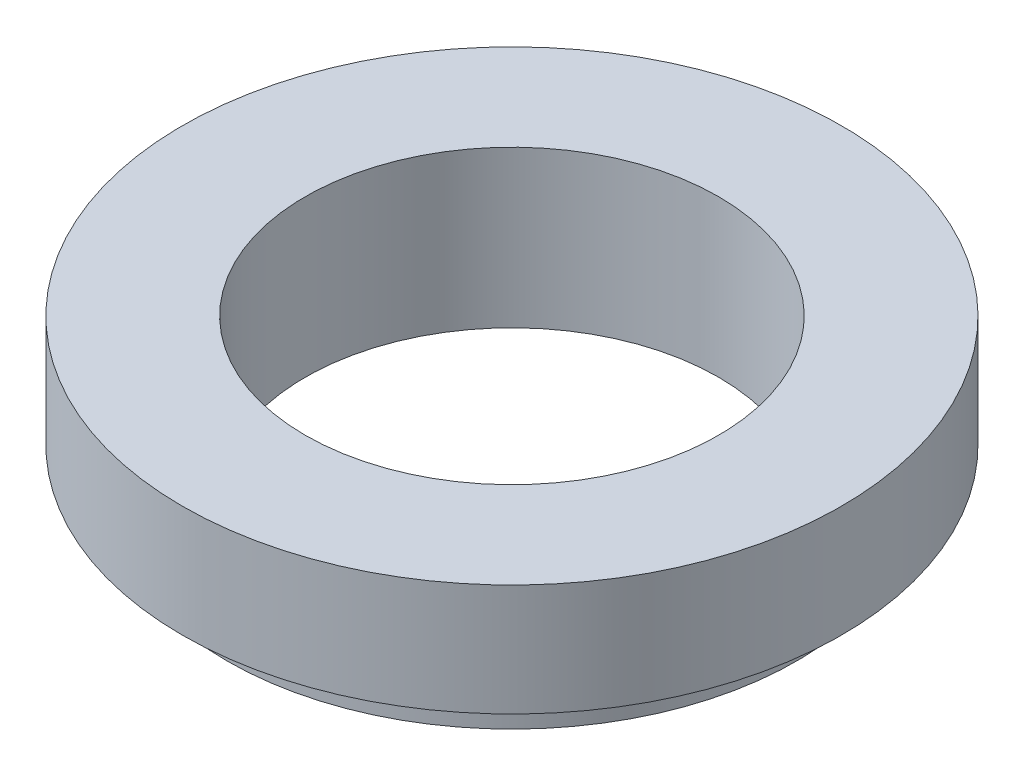
from build123d import *


with BuildPart() as part:
    # Эскиз1 → Повернуть1 (revolve)
    with BuildSketch(Plane.XY, mode=Mode.PRIVATE) as revolve_1_sk:
        Polygon((18.5, 0), (18.5, -14), (25.5, -14), (25.5, -10), (29.5, -10), (29.5, 0), align=None)
    revolve(revolve_1_sk.sketch.rotate(Axis((0, 0, 0), (0, -1, 0)), 90), axis=Axis((0, 0, 0), (0, -1, 0)))


solid = part.part
